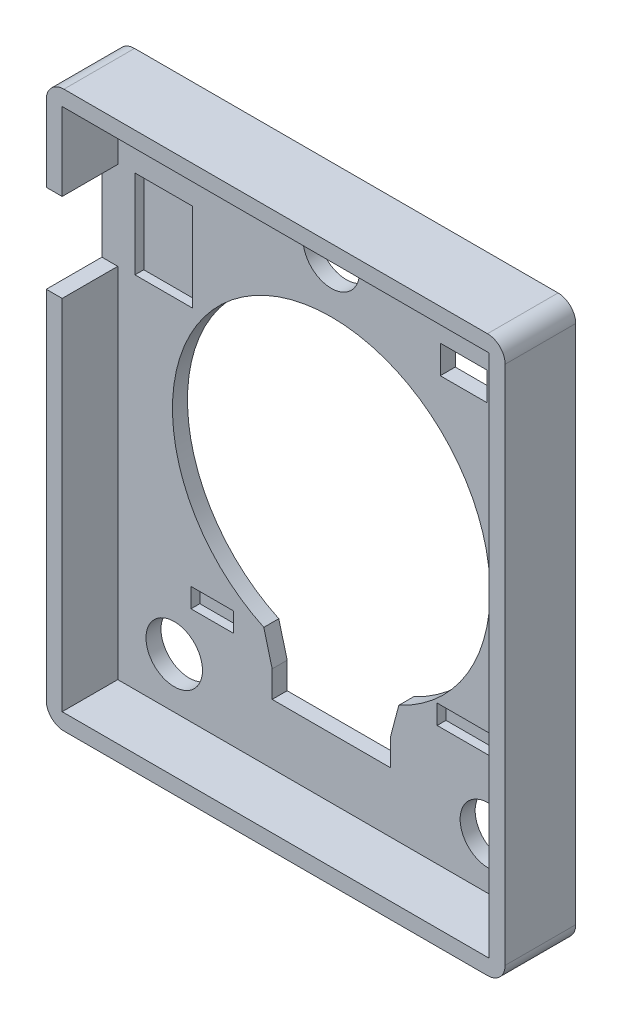
from build123d import *

# Parameters (mm, degrees)
SKETCH_1_W          = 52
SKETCH_1_H          = 63
EXTRUDE_1_DEPTH     = 8
SKETCH_2_W          = 48.4
SKETCH_2_H          = 59.4
CUT_EXTRUDE_1_DEPTH = 6.3
FILLET_1_R          = 2
CUT_EXTRUDE_2_REACH = 43.327
SKETCH_3_R          = 3.2
CUT_EXTRUDE_3_REACH = 43.327
SKETCH_4_R          = 18
SKETCH_4_W          = 13.4
SKETCH_4_H          = 3
CUT_EXTRUDE_4_REACH = 43.327
SKETCH_5_W          = 5.3
SKETCH_5_H          = 3.2
SKETCH_6_W          = 10
SKETCH_6_H          = 2.2
SKETCH_6_W_2        = 4.8
SKETCH_6_W_3        = 6.5
SKETCH_6_H_2        = 10
CUT_EXTRUDE_5_DEPTH = 1
CUT_EXTRUDE_6_REACH = 61.802
SKETCH_7_W          = 6.3
SKETCH_7_H          = 10


with BuildPart() as part:
    # 草图1 → 凸台-拉伸1 (new body)
    with BuildSketch(Plane.XY):
        Rectangle(SKETCH_1_W, SKETCH_1_H)
    extrude(amount=EXTRUDE_1_DEPTH)

    # 草图2 → 切除-拉伸1 (cut)
    with BuildSketch(Plane.XY.offset(8)):
        Rectangle(SKETCH_2_W, SKETCH_2_H)
    extrude(amount=-CUT_EXTRUDE_1_DEPTH, mode=Mode.SUBTRACT)

    # 圆角1
    fillet_1_edges = [part.edges().sort_by_distance(p)[0] for p in [
        (26, -31.5, 4),
        (-26, -31.5, 4),
        (-26, 31.5, 4),
        (26, 31.5, 4),
    ]]
    fillet(fillet_1_edges, radius=FILLET_1_R)

    # 草图3 → 切除-拉伸2 (cut, up to next)
    with BuildSketch(Plane.XY.offset(1.7), mode=Mode.PRIVATE) as cut_extrude_2_sk1:
        with Locations((0, 24)):
            Circle(SKETCH_3_R)
    cut_extrude_2_tool1 = extrude(cut_extrude_2_sk1.sketch, amount=-CUT_EXTRUDE_2_REACH, mode=Mode.PRIVATE) & part.part
    # 草图3 → 切除-拉伸2 (cut, up to next)
    with BuildSketch(Plane.XY.offset(1.7), mode=Mode.PRIVATE) as cut_extrude_2_sk2:
        with Locations((-17.8, -24)):
            Circle(SKETCH_3_R)
    cut_extrude_2_tool2 = extrude(cut_extrude_2_sk2.sketch, amount=-CUT_EXTRUDE_2_REACH, mode=Mode.PRIVATE) & part.part
    # 草图3 → 切除-拉伸2 (cut, up to next)
    with BuildSketch(Plane.XY.offset(1.7), mode=Mode.PRIVATE) as cut_extrude_2_sk3:
        with Locations((17.8, -24)):
            Circle(SKETCH_3_R)
    cut_extrude_2_tool3 = extrude(cut_extrude_2_sk3.sketch, amount=-CUT_EXTRUDE_2_REACH, mode=Mode.PRIVATE) & part.part
    add(cut_extrude_2_tool1.solids().sort_by_distance((0, 24, 1.7))[0], mode=Mode.SUBTRACT)
    add(cut_extrude_2_tool2.solids().sort_by_distance((-17.8, -24, 1.7))[0], mode=Mode.SUBTRACT)
    add(cut_extrude_2_tool3.solids().sort_by_distance((17.8, -24, 1.7))[0], mode=Mode.SUBTRACT)

    # 草图4 → 切除-拉伸3 (cut, up to next)
    with BuildSketch(Plane.XY.offset(1.7), mode=Mode.PRIVATE) as cut_extrude_3_sk1:
        Circle(SKETCH_4_R)
    cut_extrude_3_tool1 = extrude(cut_extrude_3_sk1.sketch, amount=-CUT_EXTRUDE_3_REACH, mode=Mode.PRIVATE) & part.part
    # 草图4 → 切除-拉伸3 (cut, up to next)
    with BuildSketch(Plane.XY.offset(1.7), mode=Mode.PRIVATE) as cut_extrude_3_sk2:
        with BuildLine():
            ThreePointArc((7.65, -16.293480291), (0, -18), (-7.65, -16.293480291))
            Line((-7.65, -16.293480291), (-6.7, -19.893480291))
            Line((-6.7, -19.893480291), (6.7, -19.893480291))
            Line((6.7, -19.893480291), (7.65, -16.293480291))
        make_face()
    cut_extrude_3_tool2 = extrude(cut_extrude_3_sk2.sketch, amount=-CUT_EXTRUDE_3_REACH, mode=Mode.PRIVATE) & part.part
    # 草图4 → 切除-拉伸3 (cut, up to next)
    with BuildSketch(Plane.XY.offset(1.7), mode=Mode.PRIVATE) as cut_extrude_3_sk3:
        with Locations((0, -21.393480291)):
            Rectangle(SKETCH_4_W, SKETCH_4_H)
    cut_extrude_3_tool3 = extrude(cut_extrude_3_sk3.sketch, amount=-CUT_EXTRUDE_3_REACH, mode=Mode.PRIVATE) & part.part
    add(cut_extrude_3_tool1.solids().sort_by_distance((0, 0, 1.7))[0], mode=Mode.SUBTRACT)
    add(cut_extrude_3_tool2.solids().sort_by_distance((0, -18.608129, 1.7))[0], mode=Mode.SUBTRACT)
    add(cut_extrude_3_tool3.solids().sort_by_distance((0, -21.39348, 1.7))[0], mode=Mode.SUBTRACT)

    # 草图5 → 切除-拉伸4 (cut, up to next)
    with BuildSketch(Plane.XY.offset(1.7), mode=Mode.PRIVATE) as cut_extrude_4_sk1:
        with Locations((15, 20)):
            Rectangle(SKETCH_5_W, SKETCH_5_H)
    cut_extrude_4_tool1 = extrude(cut_extrude_4_sk1.sketch, amount=-CUT_EXTRUDE_4_REACH, mode=Mode.PRIVATE) & part.part
    add(cut_extrude_4_tool1.solids().sort_by_distance((15, 20, 1.7))[0], mode=Mode.SUBTRACT)

    # 草图6 → 切除-拉伸5 (cut)
    with BuildSketch(Plane.XY.offset(1.7)):
        with Locations((-15, 25)):
            Rectangle(SKETCH_6_W, SKETCH_6_H)
        with Locations((15, 25)):
            Rectangle(SKETCH_6_W, SKETCH_6_H)
        with Locations((17, -15)):
            Rectangle(SKETCH_6_W, SKETCH_6_H)
        with Locations((-13.5, -17.5)):
            Rectangle(SKETCH_6_W_2, SKETCH_6_H)
        with Locations((-19, 16)):
            Rectangle(SKETCH_6_W_3, SKETCH_6_H_2)
    extrude(amount=-CUT_EXTRUDE_5_DEPTH, mode=Mode.SUBTRACT)

    # 草图7 → 切除-拉伸6 (cut, up to next)
    with BuildSketch(Plane(origin=(-24.2, 0, 0), x_dir=(0, 0, -1), z_dir=(1, 0, 0)), mode=Mode.PRIVATE) as cut_extrude_6_sk1:
        with Locations((-4.85, 15.863241886)):
            Rectangle(SKETCH_7_W, SKETCH_7_H)
    cut_extrude_6_tool1 = extrude(cut_extrude_6_sk1.sketch, amount=-CUT_EXTRUDE_6_REACH, mode=Mode.PRIVATE) & part.part
    add(cut_extrude_6_tool1.solids().sort_by_distance((-24.2, 15.863242, 4.85))[0], mode=Mode.SUBTRACT)


solid = part.part
